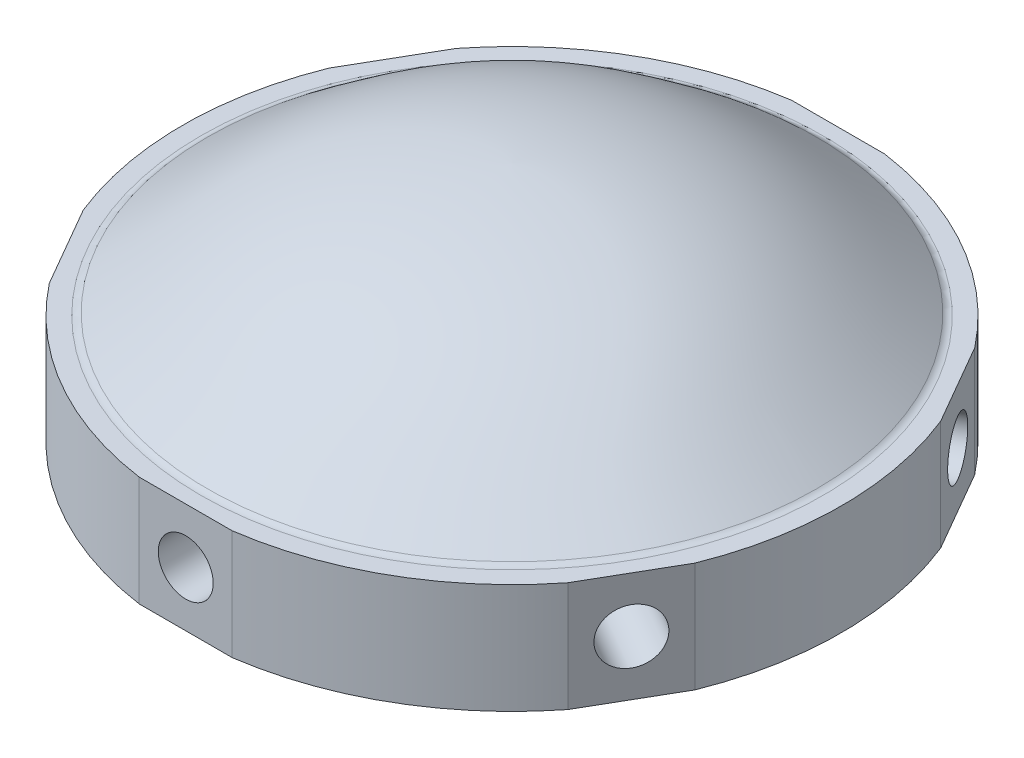
from build123d import *

# Parameters (mm, degrees)
EXTRUDE_1_DEPTH                         = 5
SKETCH_3_R                              = 5.5
EXTRUDE_2_DEPTH                         = 5
CUT_EXTRUDE_1083_REACH                  = 23.692
CUT_EXTRUDE_1083_END_RADIUS             = 5.5
SKETCH_6_R                              = 1.5
CUT_EXTRUDE_1083_DIRECTION_2_REACH      = 23.692
CUT_EXTRUDE_1083_DIRECTION_2_END_RADIUS = 5.5
FILLET_1_R                              = 0.5
PATTERN_CIRCULAR_1_COUNT                = 6
HOLE_WIZARD_6_0_6_1_D                   = 6
HOLE_WIZARD_6_0_6_1_DEPTH               = 13.5
HOLE_WIZARD_6_0_6_1_TIP                 = 1.802581857


with BuildPart() as part:
    # 草图1 → 凸台-拉伸1 (new body)
    with BuildSketch(Plane(origin=(0, 0, 0), x_dir=(1, 0, 0), z_dir=(0, 1, 0))):
        with BuildLine():
            Line((11.802472048, 9.257518758), (13.918482445, 5.592481242))
            ThreePointArc((13.918482445, 5.592481242), (15, 0), (13.918482445, -5.592481242))
            Line((13.918482445, -5.592481242), (11.802472048, -9.257518758))
            ThreePointArc((11.802472048, -9.257518758), (7.5, -12.990381057), (2.116010397, -14.85))
            Line((2.116010397, -14.85), (-2.116010397, -14.85))
            ThreePointArc((-2.116010397, -14.85), (-7.5, -12.990381057), (-11.802472048, -9.257518758))
            Line((-11.802472048, -9.257518758), (-13.918482445, -5.592481242))
            ThreePointArc((-13.918482445, -5.592481242), (-15, 0), (-13.918482445, 5.592481242))
            Line((-13.918482445, 5.592481242), (-11.802472048, 9.257518758))
            ThreePointArc((-11.802472048, 9.257518758), (-7.5, 12.990381057), (-2.116010397, 14.85))
            Line((-2.116010397, 14.85), (2.116010397, 14.85))
            ThreePointArc((2.116010397, 14.85), (7.5, 12.990381057), (11.802472048, 9.257518758))
        make_face()
    extrude(amount=EXTRUDE_1_DEPTH)

    # 草图3 → 凸台-拉伸2 (add)
    with BuildSketch(Plane.XZ):
        with Locations(Location((0, 0, 0), (0, 0, 90))):
            Circle(SKETCH_3_R)
    extrude(amount=EXTRUDE_2_DEPTH)

    # Cut-Extrude 1083: up to this cylinder (the profile starts inside it)
    cut_extrude_1083_end = Plane(origin=(0, -2.5, 0), z_dir=(0, 1, 0)) * Cylinder(CUT_EXTRUDE_1083_END_RADIUS, 59.384, mode=Mode.PRIVATE)
    # 草图6 → Cut-Extrude 1083 (cut, up to the surface)
    with BuildSketch(Plane(origin=(0, 0, 0), x_dir=(0, 0, -1), z_dir=(1, 0, 0)), mode=Mode.PRIVATE) as cut_extrude_1083_sk1:
        with Locations(Location((0, -2.5, 0), (0, 0, 180))):
            Circle(SKETCH_6_R)
    cut_extrude_1083_tool1 = extrude(cut_extrude_1083_sk1.sketch, amount=-CUT_EXTRUDE_1083_REACH, mode=Mode.PRIVATE) & cut_extrude_1083_end
    add(cut_extrude_1083_tool1.solids().sort_by_distance((0, -2.5, 0))[0], mode=Mode.SUBTRACT)

    # Cut-Extrude 1083 direction 2: up to this cylinder (the profile starts inside it)
    cut_extrude_1083_direction_2_end = Plane(origin=(0, -2.5, 0), z_dir=(0, 1, 0)) * Cylinder(CUT_EXTRUDE_1083_DIRECTION_2_END_RADIUS, 59.384, mode=Mode.PRIVATE)
    # 草图6 → Cut-Extrude 1083 direction 2 (cut, up to the surface)
    with BuildSketch(Plane(origin=(0, 0, 0), x_dir=(0, 0, -1), z_dir=(1, 0, 0)), mode=Mode.PRIVATE) as cut_extrude_1083_direction_2_sk1:
        with Locations(Location((0, -2.5, 0), (0, 0, 180))):
            Circle(SKETCH_6_R)
    cut_extrude_1083_direction_2_tool1 = extrude(cut_extrude_1083_direction_2_sk1.sketch, amount=CUT_EXTRUDE_1083_DIRECTION_2_REACH, mode=Mode.PRIVATE) & cut_extrude_1083_direction_2_end
    add(cut_extrude_1083_direction_2_tool1.solids().sort_by_distance((0, -2.5, 0))[0], mode=Mode.SUBTRACT)

    # 草图7 → 旋转1 (revolve)
    with BuildSketch(Plane.XY):
        with BuildLine():
            Line((0, 11), (0, 5))
            Line((0, 5), (14, 5))
            add(Edge.make_bspline(
                [(0, 11), (5.535231894, 10.848067736), (8.992417741, 9.000576886), (10.444270344, 7.717324106), (14, 5)],
                knots=[0, 0, 0, 0, 0, 1, 1, 1, 1, 1], degree=4))
        make_face()
    revolve(axis=Axis((0, 11, 0), (0, -1, 0)))

    # 圆角1
    fillet_1_edges = [part.edges().sort_by_distance(p)[0] for p in [
        (-14, 5, 0),
    ]]
    fillet(fillet_1_edges, radius=FILLET_1_R)

    # 草图8 → M3 螺纹孔1 (revolve, cut)
    with BuildSketch(Plane(origin=(12.860477246, 2.5, 7.425), x_dir=(0.4999999999999996, 0, -0.8660254037844389), z_dir=(0, 1, 0))):
        Polygon((0, 0), (0, 8.751075774), (1.25, 8), (1.25, 0), align=None)
    hole_wizard_m3_1 = revolve(axis=Axis((18.35973856, 2.5, 10.6), (-0.8660254037844389, 0, -0.49999999999999967)), mode=Mode.SUBTRACT)

    # 阵列(圆周)1: M3 螺纹孔1 ×6 about axis
    pattern_circular_1_axis = Axis((0, 0, 0), (0, 1, 0))
    for i in range(1, PATTERN_CIRCULAR_1_COUNT):
        add(hole_wizard_m3_1.rotate(pattern_circular_1_axis, i * 360 / PATTERN_CIRCULAR_1_COUNT), mode=Mode.SUBTRACT)

    # Ø6.0 (6) 直径孔1
    with Locations(Plane(origin=(0, -5, 0), x_dir=(0, 0, -1), z_dir=(0, -1, 0))):
        with Locations((0, 0)):
            Hole(HOLE_WIZARD_6_0_6_1_D / 2, depth=HOLE_WIZARD_6_0_6_1_DEPTH)
            with Locations((0, 0, -(HOLE_WIZARD_6_0_6_1_DEPTH + HOLE_WIZARD_6_0_6_1_TIP / 2))):  # 118° drill point
                Cone(0, HOLE_WIZARD_6_0_6_1_D / 2, HOLE_WIZARD_6_0_6_1_TIP, mode=Mode.SUBTRACT)


solid = part.part
